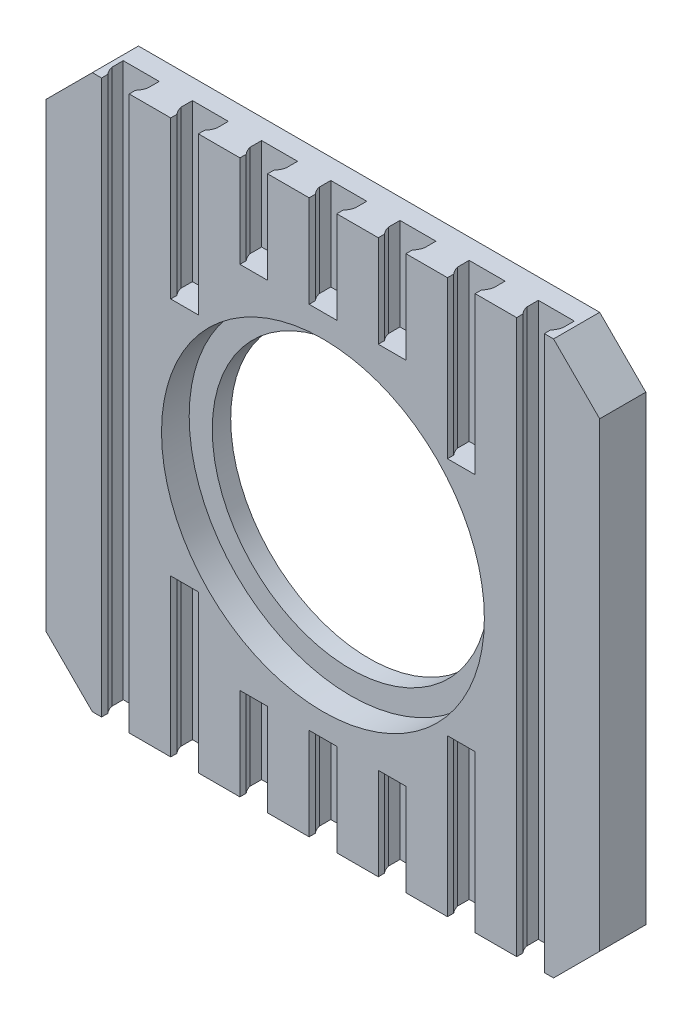
from build123d import *

# Parameters (mm, degrees)
SKETCH_1_R          = 45
EXTRUDE_1_DEPTH     = 5
SKETCH_2_W          = 60
SKETCH_2_H          = 60
EXTRUDE_2_DEPTH     = 5
CUT_EXTRUDE_1_DEPTH = 10
CUT_EXTRUDE_START   = -50
CUT_EXTRUDE_2_DEPTH = 10
CUT_EXTRUDE_3_DEPTH = 17
CUT_EXTRUDE_START_2 = -43
CUT_EXTRUDE_4_DEPTH = 17
CUT_EXTRUDE_5_REACH = 89.607
CHAMFER_1_SIZE      = 5
SKETCH_6_R          = 17.5
CUT_EXTRUDE_6_DEPTH = 3
SKETCH_7_R          = 15
CUT_EXTRUDE_7_DEPTH = 65.02343321
SKETCH_8_R          = 45
CUT_EXTRUDE_9_DEPTH = 10


with BuildPart() as part:
    # 草图1 → 凸台-拉伸1 (new body)
    with BuildSketch(Plane.XY):
        Circle(SKETCH_1_R)
    extrude(amount=-EXTRUDE_1_DEPTH)

    # 草图2 → 凸台-拉伸2 (add)
    with BuildSketch(Plane.XY):
        Rectangle(SKETCH_2_W, SKETCH_2_H)
    extrude(amount=EXTRUDE_2_DEPTH)

    # 草图3 → 切除-拉伸1 (cut)
    with BuildSketch(Plane.XZ.offset(30)):
        with BuildLine():
            Line((-1.5, 5), (1.5, 5))
            Line((1.5, 5), (1.5, 4.322875656))
            ThreePointArc((1.5, 4.322875656), (1.780042303, 3.911838473), (1.95, 3.444409721))
            Line((1.95, 3.444409721), (1.95, 2.2))
            Line((1.95, 2.2), (-1.95, 2.2))
            Line((-1.95, 2.2), (-1.95, 3.444409721))
            ThreePointArc((-1.95, 3.444409721), (-1.780042303, 3.911838473), (-1.5, 4.322875656))
            Line((-1.5, 4.322875656), (-1.5, 5))
        make_face()
        with BuildLine():
            Line((6, 5), (6, 4.322875656))
            ThreePointArc((6, 4.322875656), (5.719957697, 3.911838473), (5.55, 3.444409721))
            Line((5.55, 3.444409721), (5.55, 2.2))
            Line((5.55, 2.2), (9.45, 2.2))
            Line((9.45, 2.2), (9.45, 3.444409721))
            ThreePointArc((9.45, 3.444409721), (9.280042303, 3.911838473), (9, 4.322875656))
            Line((9, 4.322875656), (9, 5))
            Line((9, 5), (6, 5))
        make_face()
        with BuildLine():
            Line((-9, 5), (-9, 4.322875656))
            ThreePointArc((-9, 4.322875656), (-9.280042303, 3.911838473), (-9.45, 3.444409721))
            Line((-9.45, 3.444409721), (-9.45, 2.2))
            Line((-9.45, 2.2), (-5.55, 2.2))
            Line((-5.55, 2.2), (-5.55, 3.444409721))
            ThreePointArc((-5.55, 3.444409721), (-5.719957697, 3.911838473), (-6, 4.322875656))
            Line((-6, 4.322875656), (-6, 5))
            Line((-6, 5), (-9, 5))
        make_face()
    extrude(amount=-CUT_EXTRUDE_1_DEPTH, mode=Mode.SUBTRACT)

    # 草图3<2> → 切除-拉伸2 (cut)
    with BuildSketch(Plane.XZ.offset(30).offset(CUT_EXTRUDE_START)):
        with BuildLine():
            Line((-1.5, 5), (1.5, 5))
            Line((1.5, 5), (1.5, 4.322875656))
            ThreePointArc((1.5, 4.322875656), (1.780042303, 3.911838473), (1.95, 3.444409721))
            Line((1.95, 3.444409721), (1.95, 2.2))
            Line((1.95, 2.2), (-1.95, 2.2))
            Line((-1.95, 2.2), (-1.95, 3.444409721))
            ThreePointArc((-1.95, 3.444409721), (-1.780042303, 3.911838473), (-1.5, 4.322875656))
            Line((-1.5, 4.322875656), (-1.5, 5))
        make_face()
        with BuildLine():
            Line((6, 5), (6, 4.322875656))
            ThreePointArc((6, 4.322875656), (5.719957697, 3.911838473), (5.55, 3.444409721))
            Line((5.55, 3.444409721), (5.55, 2.2))
            Line((5.55, 2.2), (9.45, 2.2))
            Line((9.45, 2.2), (9.45, 3.444409721))
            ThreePointArc((9.45, 3.444409721), (9.280042303, 3.911838473), (9, 4.322875656))
            Line((9, 4.322875656), (9, 5))
            Line((9, 5), (6, 5))
        make_face()
        with BuildLine():
            Line((-9, 5), (-9, 4.322875656))
            ThreePointArc((-9, 4.322875656), (-9.280042303, 3.911838473), (-9.45, 3.444409721))
            Line((-9.45, 3.444409721), (-9.45, 2.2))
            Line((-9.45, 2.2), (-5.55, 2.2))
            Line((-5.55, 2.2), (-5.55, 3.444409721))
            ThreePointArc((-5.55, 3.444409721), (-5.719957697, 3.911838473), (-6, 4.322875656))
            Line((-6, 4.322875656), (-6, 5))
            Line((-6, 5), (-9, 5))
        make_face()
    extrude(amount=-CUT_EXTRUDE_2_DEPTH, mode=Mode.SUBTRACT)

    # 草图4 → 切除-拉伸3 (cut)
    with BuildSketch(Plane.XZ.offset(30)):
        with BuildLine():
            Line((-16.5, 5), (-13.5, 5))
            Line((-13.5, 5), (-13.5, 4.322875656))
            ThreePointArc((-13.5, 4.322875656), (-13.219957697, 3.911838473), (-13.05, 3.444409721))
            Line((-13.05, 3.444409721), (-13.05, 2.2))
            Line((-13.05, 2.2), (-16.95, 2.2))
            Line((-16.95, 2.2), (-16.95, 3.444409721))
            ThreePointArc((-16.95, 3.444409721), (-16.780042303, 3.911838473), (-16.5, 4.322875656))
            Line((-16.5, 4.322875656), (-16.5, 5))
        make_face()
        with BuildLine():
            Line((13.5, 5), (16.5, 5))
            Line((16.5, 5), (16.5, 4.322875656))
            ThreePointArc((16.5, 4.322875656), (16.780042303, 3.911838473), (16.95, 3.444409721))
            Line((16.95, 3.444409721), (16.95, 2.2))
            Line((16.95, 2.2), (13.05, 2.2))
            Line((13.05, 2.2), (13.05, 3.444409721))
            ThreePointArc((13.05, 3.444409721), (13.219957697, 3.911838473), (13.5, 4.322875656))
            Line((13.5, 4.322875656), (13.5, 5))
        make_face()
    extrude(amount=-CUT_EXTRUDE_3_DEPTH, mode=Mode.SUBTRACT)

    # 草图4<2> → 切除-拉伸4 (cut)
    with BuildSketch(Plane.XZ.offset(30).offset(CUT_EXTRUDE_START_2)):
        with BuildLine():
            Line((-16.5, 5), (-13.5, 5))
            Line((-13.5, 5), (-13.5, 4.322875656))
            ThreePointArc((-13.5, 4.322875656), (-13.219957697, 3.911838473), (-13.05, 3.444409721))
            Line((-13.05, 3.444409721), (-13.05, 2.2))
            Line((-13.05, 2.2), (-16.95, 2.2))
            Line((-16.95, 2.2), (-16.95, 3.444409721))
            ThreePointArc((-16.95, 3.444409721), (-16.780042303, 3.911838473), (-16.5, 4.322875656))
            Line((-16.5, 4.322875656), (-16.5, 5))
        make_face()
        with BuildLine():
            Line((13.5, 5), (16.5, 5))
            Line((16.5, 5), (16.5, 4.322875656))
            ThreePointArc((16.5, 4.322875656), (16.780042303, 3.911838473), (16.95, 3.444409721))
            Line((16.95, 3.444409721), (16.95, 2.2))
            Line((16.95, 2.2), (13.05, 2.2))
            Line((13.05, 2.2), (13.05, 3.444409721))
            ThreePointArc((13.05, 3.444409721), (13.219957697, 3.911838473), (13.5, 4.322875656))
            Line((13.5, 4.322875656), (13.5, 5))
        make_face()
    extrude(amount=-CUT_EXTRUDE_4_DEPTH, mode=Mode.SUBTRACT)

    # 草图5 → 切除-拉伸5 (cut, up to next)
    with BuildSketch(Plane.XZ.offset(30), mode=Mode.PRIVATE) as cut_extrude_5_sk1:
        with BuildLine():
            Line((-21, 5), (-21, 4.322875656))
            ThreePointArc((-21, 4.322875656), (-20.719957697, 3.911838473), (-20.55, 3.444409721))
            Line((-20.55, 3.444409721), (-20.55, 2.2))
            Line((-20.55, 2.2), (-24.45, 2.2))
            Line((-24.45, 2.2), (-24.45, 3.444409721))
            ThreePointArc((-24.45, 3.444409721), (-24.280042303, 3.911838473), (-24, 4.322875656))
            Line((-24, 4.322875656), (-24, 5))
            Line((-24, 5), (-21, 5))
        make_face()
    cut_extrude_5_tool1 = extrude(cut_extrude_5_sk1.sketch, amount=-CUT_EXTRUDE_5_REACH, mode=Mode.PRIVATE) & part.part
    # 草图5 → 切除-拉伸5 (cut, up to next)
    with BuildSketch(Plane.XZ.offset(30), mode=Mode.PRIVATE) as cut_extrude_5_sk2:
        with BuildLine():
            Line((24, 5), (24, 4.322875656))
            ThreePointArc((24, 4.322875656), (24.280042303, 3.911838473), (24.45, 3.444409721))
            Line((24.45, 3.444409721), (24.45, 2.2))
            Line((24.45, 2.2), (20.55, 2.2))
            Line((20.55, 2.2), (20.55, 3.444409721))
            ThreePointArc((20.55, 3.444409721), (20.719957697, 3.911838473), (21, 4.322875656))
            Line((21, 4.322875656), (21, 5))
            Line((21, 5), (24, 5))
        make_face()
    cut_extrude_5_tool2 = extrude(cut_extrude_5_sk2.sketch, amount=-CUT_EXTRUDE_5_REACH, mode=Mode.PRIVATE) & part.part
    add(cut_extrude_5_tool1.solids().sort_by_distance((-22.5, -30, 3.520698))[0], mode=Mode.SUBTRACT)
    add(cut_extrude_5_tool2.solids().sort_by_distance((22.5, -30, 3.520698))[0], mode=Mode.SUBTRACT)

    # 倒角1
    chamfer_1_edges = [part.edges().sort_by_distance(p)[0] for p in [
        (-30, 30, 2.5),
        (30, 30, 2.5),
        (30, -30, 2.5),
        (-30, -30, 2.5),
    ]]
    chamfer(chamfer_1_edges, length=CHAMFER_1_SIZE)

    # 草图6 → 切除-拉伸6 (cut)
    with BuildSketch(Plane.XY.offset(5)):
        Circle(SKETCH_6_R)
    extrude(amount=-CUT_EXTRUDE_6_DEPTH, mode=Mode.SUBTRACT)

    # 草图7 → 切除-拉伸7 (cut, through all)
    with BuildSketch(Plane.XY.offset(2)):
        Circle(SKETCH_7_R)
    extrude(amount=-CUT_EXTRUDE_7_DEPTH, mode=Mode.SUBTRACT)

    # 草图8 → 切除-拉伸9 (cut)
    with BuildSketch(Plane.XY):
        Circle(SKETCH_8_R)
    extrude(amount=-CUT_EXTRUDE_9_DEPTH, mode=Mode.SUBTRACT)


solid = part.part
